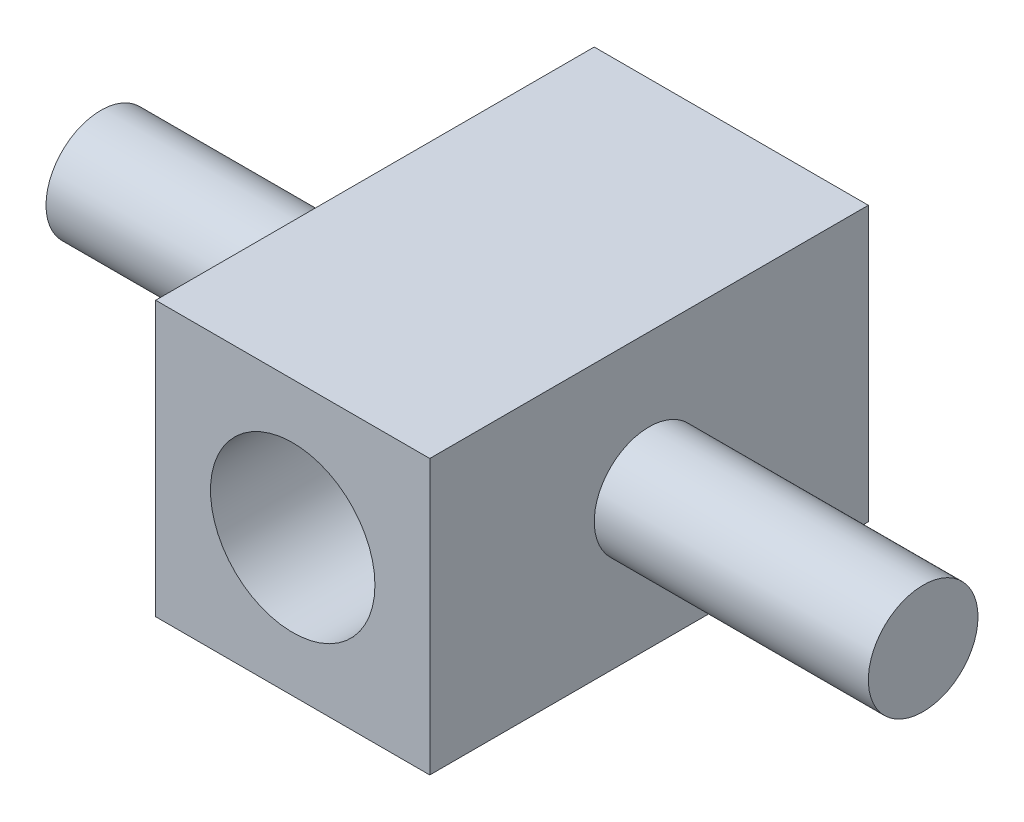
from build123d import *

# Parameters (mm, degrees)
BOSS_EXTRUDE1_DEPTH      = 5.08
BOSS_EXTRUDE1_DEPTH_BACK = 5.08
SKETCH1_W                = 6.35
SKETCH1_H                = 6.35
SKETCH1_R                = 1.905
SKETCH2_R                = 1.27
BOSS_EXTRUDE2_DEPTH      = 6.35
BOSS_EXTRUDE3_START      = 6.35
SKETCH3_R                = 1.27
BOSS_EXTRUDE3_DEPTH      = 6.35
SCALE1_SCALE             = 8


with BuildPart() as part:
    # Sketch1 → Boss-Extrude1 (new, two sides: drawn at the far end of the back side and taken through both)
    with BuildSketch(Plane.XY.offset(-BOSS_EXTRUDE1_DEPTH_BACK)):
        Rectangle(SKETCH1_W, SKETCH1_H)
        Circle(SKETCH1_R, mode=Mode.SUBTRACT)
    extrude(amount=BOSS_EXTRUDE1_DEPTH + BOSS_EXTRUDE1_DEPTH_BACK)

    # Sketch2 → Boss-Extrude2 (add)
    with BuildSketch(Plane.ZY.offset(3.175)):
        Circle(SKETCH2_R)
    extrude(amount=BOSS_EXTRUDE2_DEPTH)

    # Sketch3 → Boss-Extrude3 (add)
    with BuildSketch(Plane(origin=(3.175, 0, 0), x_dir=(0, 0, -1), z_dir=(1, 0, 0)).offset(BOSS_EXTRUDE3_START)):
        Circle(SKETCH3_R)
    extrude(amount=-BOSS_EXTRUDE3_DEPTH)


with BuildPart() as part_1:
    # Scale1: scaled about (0, 0, 0)
    add(part.part.scale(SCALE1_SCALE))


solid = part_1.part
